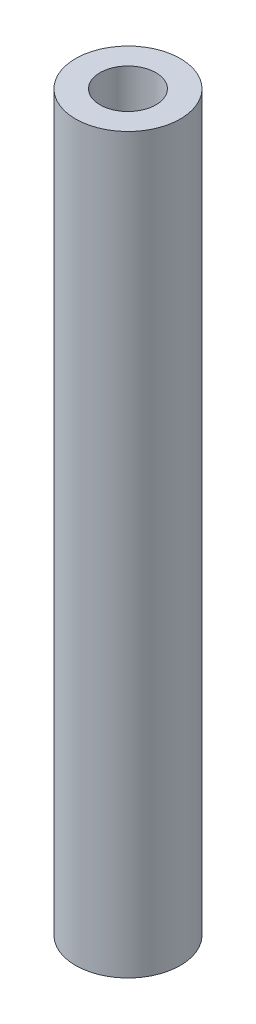
from build123d import *

# Parameters (mm, degrees)
SKETCH1_R           = 4.7625
SKETCH1_R_2         = 2.54
BOSS_EXTRUDE1_DEPTH = 66.675


with BuildPart() as part:
    # Sketch1 → Boss-Extrude1 (new body)
    with BuildSketch(Plane(origin=(0, 0, 0), x_dir=(1, 0, 0), z_dir=(0, 1, 0))):
        with Locations(Location((0, 0, 0), (0, 0, 270))):
            Circle(SKETCH1_R)
        with Locations(Location((0, 0, 0), (0, 0, 270))):
            Circle(SKETCH1_R_2, mode=Mode.SUBTRACT)
    extrude(amount=BOSS_EXTRUDE1_DEPTH)


solid = part.part
